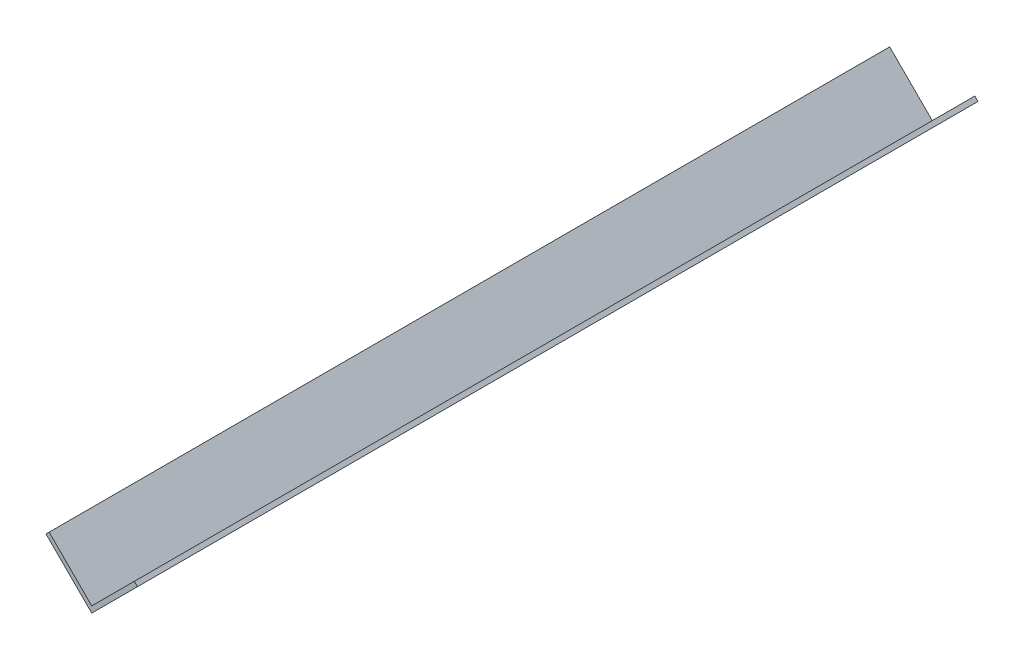
from build123d import *

# Parameters (mm, degrees)
BOSS_EXTRUDE1_DEPTH = 330.2


with BuildPart() as part:
    # Sketch1 → Boss-Extrude1 (new body)
    with BuildSketch(Plane.XY):
        Polygon((0, 0), (-17.960512242, 17.960512242), (-16.725727025, 19.195297459), (0, 2.469570433), (16.725727025, 19.195297459), (17.960512242, 17.960512242), align=None)
    extrude(amount=BOSS_EXTRUDE1_DEPTH)


solid = part.part
